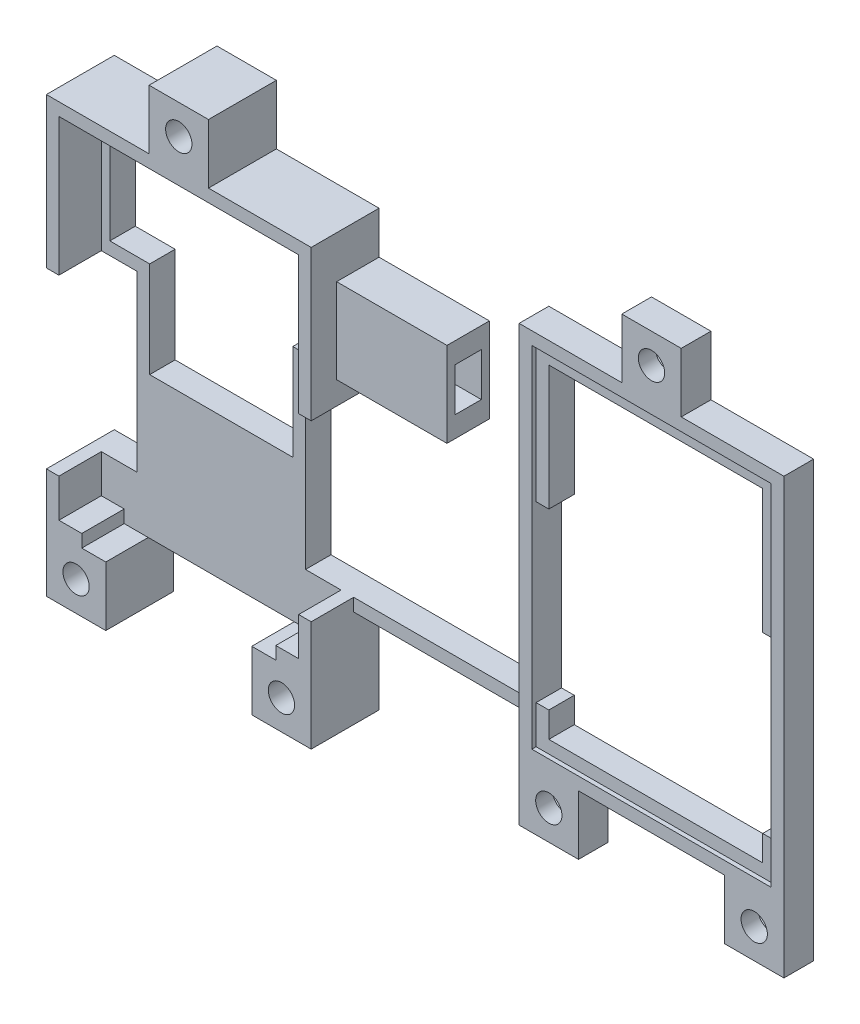
from build123d import *

# Parameters (mm, degrees)
BOSS_EXTRUDE1_DEPTH = 3
BOSS_EXTRUDE2_DEPTH = 5
SKETCH1_4_W         = 13
SKETCH1_4_H         = 10
BOSS_EXTRUDE3_DEPTH = 5
SKETCH2_W           = 3.1
SKETCH2_H           = 5.1
CUT_EXTRUDE1_DEPTH  = 6
SKETCH1_5_W         = 31.2
SKETCH1_5_H         = 44.2
SKETCH1_5_W_2       = 28.248651934
SKETCH1_5_H_2       = 41.207612078
BOSS_EXTRUDE4_DEPTH = 8
SKETCH3_W           = 20
SKETCH3_H           = 1.5
BOSS_EXTRUDE5_DEPTH = 3
SKETCH1_6_W         = 1.475674033
SKETCH1_6_H         = 20.5
CUT_EXTRUDE2_DEPTH  = 25
SKETCH1_7_W         = 1.475674033
SKETCH1_7_H         = 20.5
CUT_EXTRUDE3_DEPTH  = 43.658762289
CUT_EXTRUDE4_DEPTH  = 43.199170608
SKETCH6_W           = 22.86
SKETCH6_H           = 1.496193961
CUT_EXTRUDE5_DEPTH  = 5
BOSS_EXTRUDE6_DEPTH = 3
SKETCH7_4_W         = 7
SKETCH7_4_H         = 7
SKETCH7_4_W_2       = 3.5
BOSS_EXTRUDE8_DEPTH = 3.5
SKETCH8_W           = 7
SKETCH8_H           = 7
BOSS_EXTRUDE9_DEPTH = 8
SKETCH9_R           = 1.55
CUT_EXTRUDE6_DEPTH  = 74.301091397
SKETCH9_3_R         = 1.55
CUT_EXTRUDE7_DEPTH  = 4
SKETCH9_4_R         = 1.55
CUT_EXTRUDE8_DEPTH  = 1.5


with BuildPart() as part:
    # Sketch1 → Boss-Extrude1 (new body)
    with BuildSketch(Plane.XY):
        Polygon((9.93, 4.4), (14.124325967, 4.4), (14.124325967, 20.603806039), (-14.124325967, 20.603806039), (-14.124325967, 4.4), (-9.93, 4.4), (-9.93, -16.1), (-14.124325967, -16.1), (-14.124325967, -20.603806039), (14.124325967, -20.603806039), (14.124325967, -16.1), (9.93, -16.1), align=None)
    extrude(amount=BOSS_EXTRUDE1_DEPTH)

    # Sketch1<3> → Boss-Extrude2 (add)
    with BuildSketch(Plane.XY):
        Polygon((15.6, 22.1), (-15.6, 22.1), (-15.6, -22.1), (15.6, -22.1), (15.6, -16.1), (14.124325967, -16.1), (14.124325967, -20.603806039), (-14.124325967, -20.603806039), (-14.124325967, 20.603806039), (14.124325967, 20.603806039), (14.124325967, 4.4), (15.6, 4.4), align=None)
    extrude(amount=BOSS_EXTRUDE2_DEPTH)

    # Sketch1<4> → Boss-Extrude3 (add)
    with BuildSketch(Plane.XY):
        with Locations((22.1, 12.1)):
            Rectangle(SKETCH1_4_W, SKETCH1_4_H)
    extrude(amount=BOSS_EXTRUDE3_DEPTH)

    # Sketch2 → Cut-Extrude1 (cut)
    with BuildSketch(Plane(origin=(28.6, 0, 0), x_dir=(0, 0, -1), z_dir=(1, 0, 0))):
        with Locations((-2.5, 12.1)):
            Rectangle(SKETCH2_W, SKETCH2_H)
    extrude(amount=-CUT_EXTRUDE1_DEPTH, mode=Mode.SUBTRACT)

    # Sketch1<5> → Boss-Extrude4 (add)
    with BuildSketch(Plane.XY):
        Rectangle(SKETCH1_5_W, SKETCH1_5_H)
        Rectangle(SKETCH1_5_W_2, SKETCH1_5_H_2, mode=Mode.SUBTRACT)
    extrude(amount=BOSS_EXTRUDE4_DEPTH)

    # Sketch3 → Boss-Extrude5 (add)
    with BuildSketch(Plane(origin=(0, 0, 0), x_dir=(-1, 0, 0), z_dir=(0, 0, -1))):
        with Locations((-25.6, -16.85)):
            Rectangle(SKETCH3_W, SKETCH3_H)
    extrude(amount=-BOSS_EXTRUDE5_DEPTH)

    # Sketch1<6> → Cut-Extrude2 (cut)
    with BuildSketch(Plane.XY):
        with Locations((-14.862162984, -5.85)):
            Rectangle(SKETCH1_6_W, SKETCH1_6_H)
    extrude(amount=CUT_EXTRUDE2_DEPTH, mode=Mode.SUBTRACT)

    # Sketch1<7> → Cut-Extrude3 (cut, through all)
    with BuildSketch(Plane.XY):
        with Locations((14.862162984, -5.85)):
            Rectangle(SKETCH1_7_W, SKETCH1_7_H)
    extrude(amount=CUT_EXTRUDE3_DEPTH, mode=Mode.SUBTRACT)

    # Sketch4 → Cut-Extrude4 (cut, through all)
    with BuildSketch(Plane.XY.offset(3)):
        Polygon((-13.124325967, 19.603806039), (13.124325967, 19.603806039), (13.124325967, 5.9), (8.43, 5.9), (8.43, -5.396193961), (-8.43, -5.396193961), (-8.43, 5.9), (-13.124325967, 5.9), align=None)
    extrude(amount=-CUT_EXTRUDE4_DEPTH, mode=Mode.SUBTRACT)

    # Sketch6 → Cut-Extrude5 (cut)
    with BuildSketch(Plane.XY.offset(8)):
        with Locations((0, -21.351903019)):
            Rectangle(SKETCH6_W, SKETCH6_H)
    extrude(amount=-CUT_EXTRUDE5_DEPTH, mode=Mode.SUBTRACT)



with BuildPart() as body_2:
    # Sketch7 → Boss-Extrude6 (new body)
    with BuildSketch(Plane.XY):
        Polygon((51.2, 19.1), (51.2, 20.6), (37.1, 20.6), (37.1, 4.4), (38.6, 4.4), (38.6, 19.1), align=None)
        Polygon((65.3, 20.6), (51.2, 20.6), (51.2, 19.1), (63.8, 19.1), (63.8, 4.4), (65.3, 4.4), align=None)
        Polygon((63.8, -19.1), (51.2, -19.1), (51.2, -20.6), (65.3, -20.6), (65.3, -16.1), (63.8, -16.1), align=None)
        Polygon((51.2, -20.6), (51.2, -19.1), (38.6, -19.1), (38.6, -16.1), (37.1, -16.1), (37.1, -20.6), align=None)
    extrude(amount=BOSS_EXTRUDE6_DEPTH)


with BuildPart() as part_1:
    add(part.part)

    add(body_2.part)  # Boss-Extrude8 merges body 2
    # Sketch7<4> → Boss-Extrude8 (add)
    with BuildSketch(Plane.XY):
        Polygon((47.7, 22.1), (35.6, 22.1), (35.6, -22.1), (42.6, -22.1), (49.2, -22.1), (51.2, -22.1), (51.2, -20.6), (37.1, -20.6), (37.1, -16.1), (37.1, 4.4), (37.1, 20.6), (51.2, 20.6), (51.2, 22.1), align=None)
        Polygon((54.7, 22.1), (51.2, 22.1), (51.2, 20.6), (65.3, 20.6), (65.3, 4.4), (65.3, -16.1), (65.3, -20.6), (51.2, -20.6), (51.2, -22.1), (53.2, -22.1), (59.8, -22.1), (66.8, -22.1), (66.8, 22.1), align=None)
        with Locations((63.3, -25.6)):
            Rectangle(SKETCH7_4_W, SKETCH7_4_H)
        with Locations((39.1, -25.6)):
            Rectangle(SKETCH7_4_W, SKETCH7_4_H)
        with Locations((52.95, 25.6)):
            Rectangle(SKETCH7_4_W_2, SKETCH7_4_H)
        with Locations((49.45, 25.6)):
            Rectangle(SKETCH7_4_W_2, SKETCH7_4_H)
    extrude(amount=BOSS_EXTRUDE8_DEPTH)

    # Sketch8 → Boss-Extrude9 (add)
    with BuildSketch(Plane.XY):
        with Locations((12.1, -25.6)):
            Rectangle(SKETCH8_W, SKETCH8_H)
        with Locations((0, 25.6)):
            Rectangle(SKETCH8_W, SKETCH8_H)
        with Locations((-12.1, -25.6)):
            Rectangle(SKETCH8_W, SKETCH8_H)
    extrude(amount=BOSS_EXTRUDE9_DEPTH)

    # Sketch9 → Cut-Extrude6 (cut, through all)
    with BuildSketch(Plane(origin=(0, 0, 0), x_dir=(-1, 0, 0), z_dir=(0, 0, -1))):
        with Locations((-63.3, -25.6)):
            Circle(SKETCH9_R)
        with Locations((-39.1, -25.6)):
            Circle(SKETCH9_R)
        with Locations((-12.1, -25.6)):
            Circle(SKETCH9_R)
        with Locations((12.1, -25.6)):
            Circle(SKETCH9_R)
        with Locations((0, 25.6)):
            Circle(SKETCH9_R)
        with Locations((-51.2, 25.6)):
            Circle(SKETCH9_R)
    extrude(amount=-CUT_EXTRUDE6_DEPTH, mode=Mode.SUBTRACT)

    # Sketch9<3> → Cut-Extrude7 (cut)
    # profile 1 of 3: a face of its own
    with BuildSketch(Plane(origin=(0, 0, 0), x_dir=(-1, 0, 0), z_dir=(0, 0, -1))):
        Polygon((0, 22.425), (2.749630657, 24.0125), (2.749630657, 27.1875), (0, 28.775), (-2.749630657, 27.1875), (-2.749630657, 24.0125), align=None)
        with Locations((0, 25.6)):
            Circle(SKETCH9_3_R, mode=Mode.SUBTRACT)
    # profile 2 of 3: a face of its own
    with BuildSketch(Plane(origin=(0, 0, 0), x_dir=(-1, 0, 0), z_dir=(0, 0, -1))):
        Polygon((9.350369343, -27.1875), (9.350369343, -24.0125), (12.1, -22.425), (14.849630657, -24.0125), (14.849630657, -27.1875), (12.1, -28.775), align=None)
        with Locations((12.1, -25.6)):
            Circle(SKETCH9_3_R, mode=Mode.SUBTRACT)
    # profile 3 of 3: a face of its own
    with BuildSketch(Plane(origin=(0, 0, 0), x_dir=(-1, 0, 0), z_dir=(0, 0, -1))):
        Polygon((-14.849630657, -27.1875), (-12.1, -28.775), (-9.350369343, -27.1875), (-9.350369343, -24.0125), (-12.1, -22.425), (-14.849630657, -24.0125), align=None)
        with Locations((-12.1, -25.6)):
            Circle(SKETCH9_3_R, mode=Mode.SUBTRACT)
    extrude(amount=-CUT_EXTRUDE7_DEPTH, mode=Mode.SUBTRACT)

    # Sketch9<4> → Cut-Extrude8 (cut)
    # profile 1 of 3: a face of its own
    with BuildSketch(Plane(origin=(0, 0, 0), x_dir=(-1, 0, 0), z_dir=(0, 0, -1))):
        Polygon((-53.949630657, 24.0125), (-51.2, 22.425), (-48.450369343, 24.0125), (-48.450369343, 27.1875), (-51.2, 28.775), (-53.949630657, 27.1875), align=None)
        with Locations((-51.2, 25.6)):
            Circle(SKETCH9_4_R, mode=Mode.SUBTRACT)
    # profile 2 of 3: a face of its own
    with BuildSketch(Plane(origin=(0, 0, 0), x_dir=(-1, 0, 0), z_dir=(0, 0, -1))):
        Polygon((-66.049630657, -27.1875), (-63.3, -28.775), (-60.550369343, -27.1875), (-60.550369343, -24.0125), (-63.3, -22.425), (-66.049630657, -24.0125), align=None)
        with Locations((-63.3, -25.6)):
            Circle(SKETCH9_4_R, mode=Mode.SUBTRACT)
    # profile 3 of 3: a face of its own
    with BuildSketch(Plane(origin=(0, 0, 0), x_dir=(-1, 0, 0), z_dir=(0, 0, -1))):
        Polygon((-41.849630657, -27.1875), (-41.849630657, -24.0125), (-39.1, -22.425), (-36.350369343, -24.0125), (-36.350369343, -27.1875), (-39.1, -28.775), align=None)
        with Locations((-39.1, -25.6)):
            Circle(SKETCH9_4_R, mode=Mode.SUBTRACT)
    extrude(amount=-CUT_EXTRUDE8_DEPTH, mode=Mode.SUBTRACT)


solid = part_1.part
